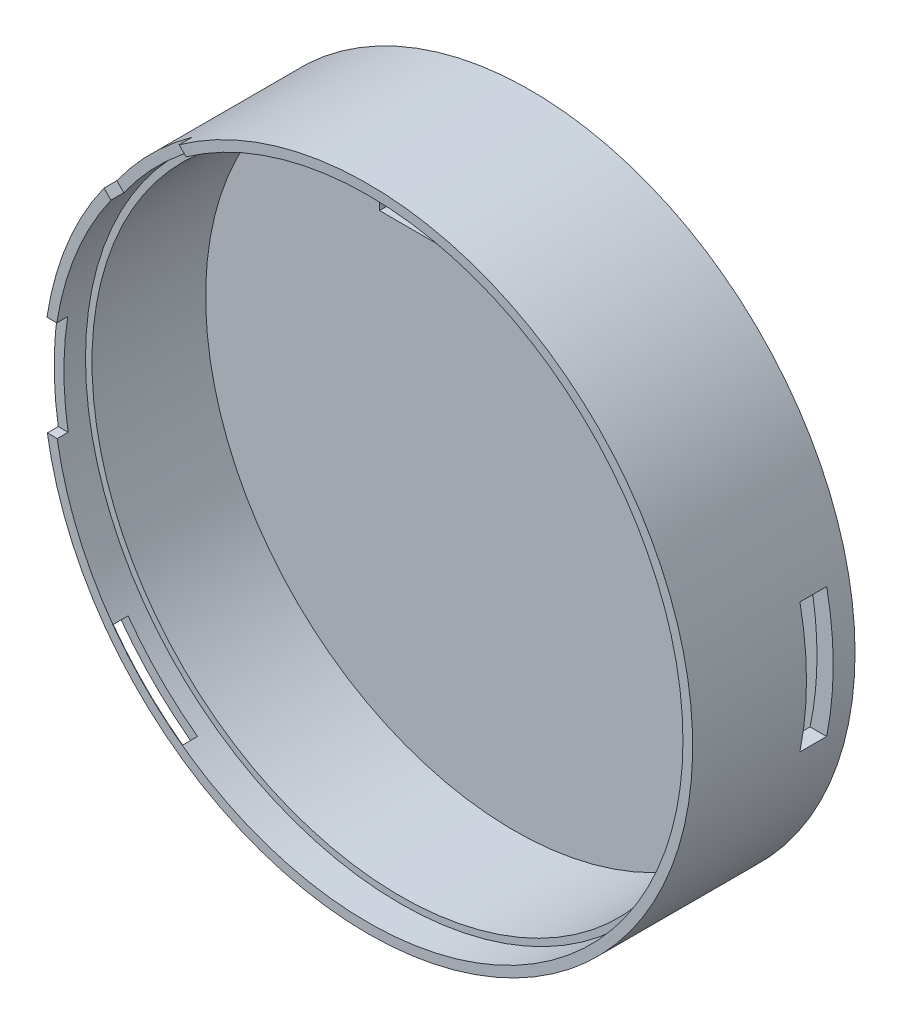
from build123d import *

# Parameters (mm, degrees)
SKETCH_1_R          = 100
EXTRUDE_2_DEPTH     = 50
SHELL_2_T           = -5
SKETCH_6_W          = 82.913902184
SKETCH_6_H          = 6.735302979
CUT_EXTRUDE_1_DEPTH = 10
SKETCH_9_R          = 97
CUT_EXTRUDE_2_DEPTH = 10
SKETCH_13_W         = 6
SKETCH_13_H         = 30.793483952
CUT_EXTRUDE_3_DEPTH = 10
SKETCH_16_W         = 8.245924623
SKETCH_16_H         = 40.008749502
CUT_EXTRUDE_6_DEPTH = 10
SKETCH_17_W         = 4.583098869
SKETCH_17_H         = 30.302333069
CUT_EXTRUDE_7_DEPTH = 10
SKETCH_18_W         = 6.507967363
SKETCH_18_H         = 32.713121907
CUT_EXTRUDE_8_DEPTH = 10


with BuildPart() as part:
    # 草图1 → 凸台-拉伸2 (new body)
    with BuildSketch(Plane.XY):
        Circle(SKETCH_1_R)
    extrude(amount=EXTRUDE_2_DEPTH)

    # 抽壳2
    shell_2_openings = [part.faces().sort_by_distance(p)[0] for p in [
        (0, 0, 50),
    ]]
    offset(amount=SHELL_2_T, openings=shell_2_openings, kind=Kind.INTERSECTION)

    # 草图6 → 切除-拉伸1 (cut)
    with BuildSketch(Plane.XY):
        with Locations((0, 53.011479478)):
            Rectangle(SKETCH_6_W, SKETCH_6_H)
    extrude(amount=CUT_EXTRUDE_1_DEPTH, mode=Mode.SUBTRACT)

    # 草图9 → 切除-拉伸2 (cut)
    with BuildSketch(Plane.XY.offset(50)):
        Circle(SKETCH_9_R)
    extrude(amount=-CUT_EXTRUDE_2_DEPTH, mode=Mode.SUBTRACT)

    # 草图13 → 切除-拉伸3 (cut)
    with BuildSketch(Plane.ZY.offset(100)):
        with Locations((49.635646507, -0.396741976)):
            Rectangle(SKETCH_13_W, SKETCH_13_H)
    extrude(amount=-CUT_EXTRUDE_3_DEPTH, mode=Mode.SUBTRACT)

    # 草图16 → 切除-拉伸6 (cut)
    with BuildSketch(Plane(origin=(100, 0, 0), x_dir=(0, 0, -1), z_dir=(1, 0, 0))):
        with Locations((-10.841517517, -0.038286219)):
            Rectangle(SKETCH_16_W, SKETCH_16_H)
    extrude(amount=-CUT_EXTRUDE_6_DEPTH, mode=Mode.SUBTRACT)

    # 草图17 → 切除-拉伸7 (cut)
    with BuildSketch(Plane(origin=(-70.710678119, -70.710678119, 0), x_dir=(0, 0, -1), z_dir=(-0.7071067811865464, -0.7071067811865488, 0))):
        with Locations((-47.581138772, -0.207959565)):
            Rectangle(SKETCH_17_W, SKETCH_17_H)
    extrude(amount=-CUT_EXTRUDE_7_DEPTH, mode=Mode.SUBTRACT)

    # 草图18 → 切除-拉伸8 (cut)
    with BuildSketch(Plane(origin=(-70.710678119, 70.710678119, 0), x_dir=(0, 0, 1), z_dir=(-0.7071067811865487, 0.7071067811865465, 0))):
        with Locations((49.297240538, 0.044727536)):
            Rectangle(SKETCH_18_W, SKETCH_18_H)
    extrude(amount=-CUT_EXTRUDE_8_DEPTH, mode=Mode.SUBTRACT)


solid = part.part
